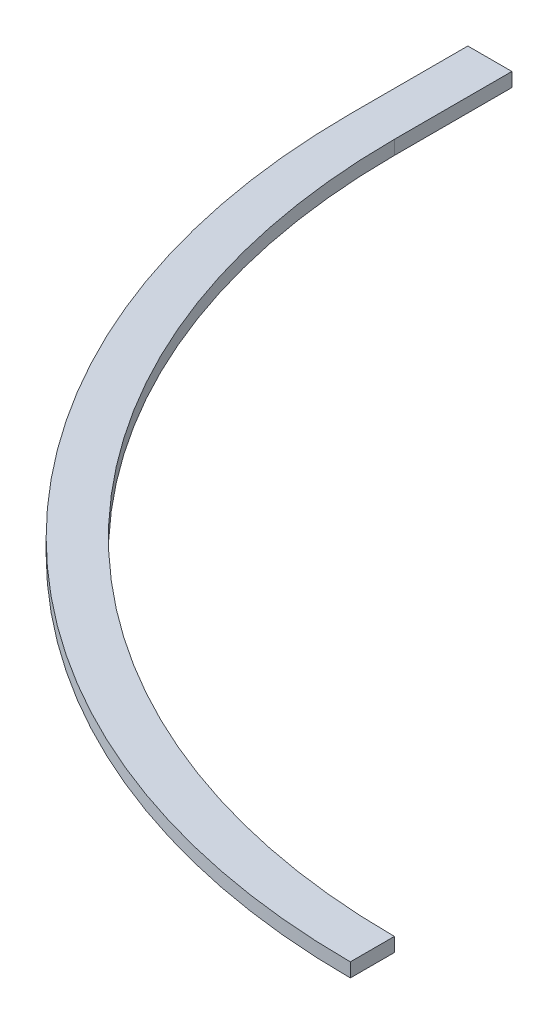
from build123d import *

# Parameters (mm, degrees)
BOSS_EXTRUDE1_DEPTH = 9.525
SKETCH3_W           = 30
SKETCH3_H           = 9.525
BOSS_EXTRUDE2_DEPTH = 80


with BuildPart() as part:
    # Sketch2 → Boss-Extrude1 (new body)
    with BuildSketch(Plane(origin=(0, 0, 0), x_dir=(1, 0, 0), z_dir=(0, 1, 0))):
        with BuildLine():
            ThreePointArc((0, -470), (-332.340187158, -332.340187158), (-470, 0))
            Line((-470, 0), (-500, 0))
            ThreePointArc((-500, 0), (-353.553390593, -353.553390593), (0, -500))
            Line((0, -500), (0, -470))
        make_face()
    extrude(amount=BOSS_EXTRUDE1_DEPTH)

    # Sketch3 → Boss-Extrude2 (add)
    with BuildSketch(Plane(origin=(0, 0, 0), x_dir=(-1, 0, 0), z_dir=(0, 0, -1))):
        with Locations((485, 4.7625)):
            Rectangle(SKETCH3_W, SKETCH3_H)
    extrude(amount=BOSS_EXTRUDE2_DEPTH)


solid = part.part
